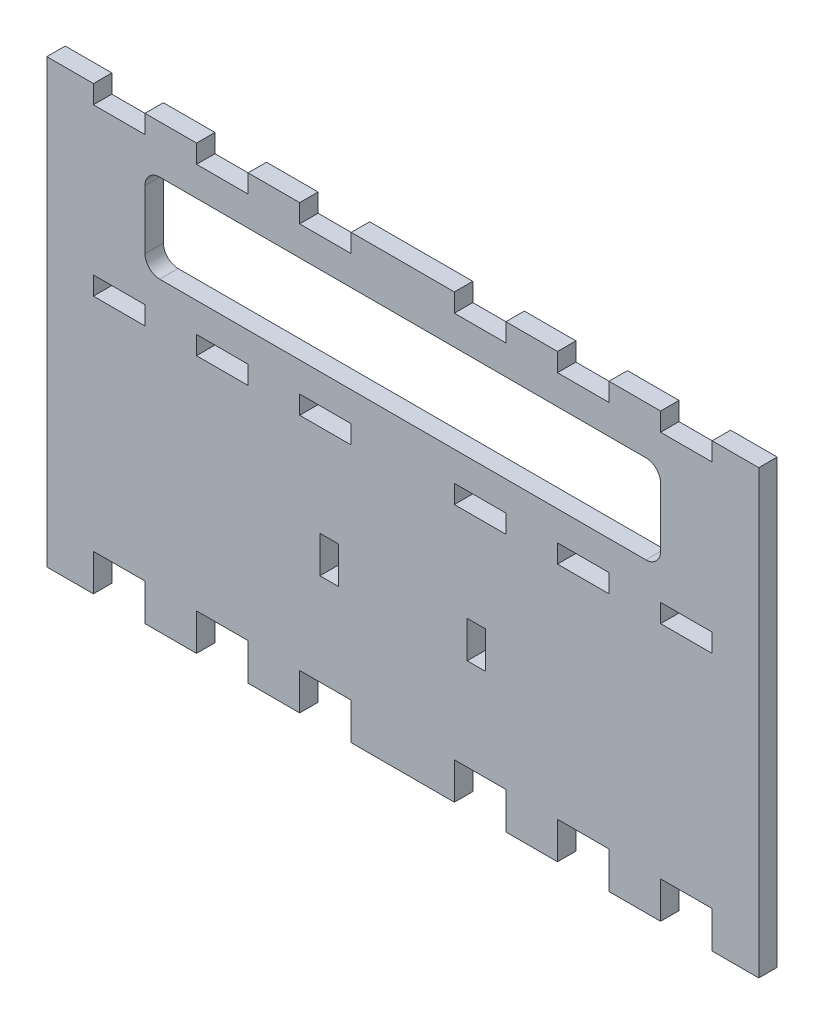
from build123d import *

# Parameters (mm, degrees)
SKETCH1_W           = 7
SKETCH1_H           = 2.5
SKETCH1_W_2         = 2.5
SKETCH1_H_2         = 5
BOSS_EXTRUDE1_DEPTH = 2.5


with BuildPart() as part:
    # Sketch1 → Boss-Extrude1 (new body)
    with BuildSketch(Plane.XY):
        Polygon((-48.325, -30), (-42, -30), (-42, -25), (-35, -25), (-35, -30), (-28, -30), (-28, -25), (-21, -25), (-21, -30), (-14, -30), (-14, -25), (-7, -25), (-7, -30), (7, -30), (7, -25), (14, -25), (14, -30), (21, -30), (21, -25), (28, -25), (28, -30), (35, -30), (35, -25), (42, -25), (42, -30), (48.325, -30), (48.325, 30), (42, 30), (42, 27.5), (35, 27.5), (35, 30), (28, 30), (28, 27.5), (21, 27.5), (21, 30), (14, 30), (14, 27.5), (7, 27.5), (7, 30), (-7, 30), (-7, 27.5), (-14, 27.5), (-14, 30), (-21, 30), (-21, 27.5), (-28, 27.5), (-28, 30), (-35, 30), (-35, 27.5), (-42, 27.5), (-42, 30), (-48.325, 30), align=None)
        with Locations((24.5, 6.25)):
            Rectangle(SKETCH1_W, SKETCH1_H, mode=Mode.SUBTRACT)
        with Locations((38.5, 6.25)):
            Rectangle(SKETCH1_W, SKETCH1_H, mode=Mode.SUBTRACT)
        with Locations((10.5, 6.25)):
            Rectangle(SKETCH1_W, SKETCH1_H, mode=Mode.SUBTRACT)
        with Locations((-38.5, 6.25)):
            Rectangle(SKETCH1_W, SKETCH1_H, mode=Mode.SUBTRACT)
        with Locations((-24.5, 6.25)):
            Rectangle(SKETCH1_W, SKETCH1_H, mode=Mode.SUBTRACT)
        with Locations((-10.5, 6.25)):
            Rectangle(SKETCH1_W, SKETCH1_H, mode=Mode.SUBTRACT)
        with Locations((-10, -10)):
            Rectangle(SKETCH1_W_2, SKETCH1_H_2, mode=Mode.SUBTRACT)
        with BuildLine():
            Line((-33, 11.5), (33, 11.5))
            ThreePointArc((33, 11.5), (34.414213562, 12.085786438), (35, 13.5))
            Line((35, 13.5), (35, 21.5))
            ThreePointArc((35, 21.5), (34.414213562, 22.914213562), (33, 23.5))
            Line((33, 23.5), (-33, 23.5))
            ThreePointArc((-33, 23.5), (-34.414213562, 22.914213562), (-35, 21.5))
            Line((-35, 21.5), (-35, 13.5))
            ThreePointArc((-35, 13.5), (-34.414213562, 12.085786438), (-33, 11.5))
        make_face(mode=Mode.SUBTRACT)
        with Locations((10, -10)):
            Rectangle(SKETCH1_W_2, SKETCH1_H_2, mode=Mode.SUBTRACT)
    extrude(amount=BOSS_EXTRUDE1_DEPTH)


solid = part.part
